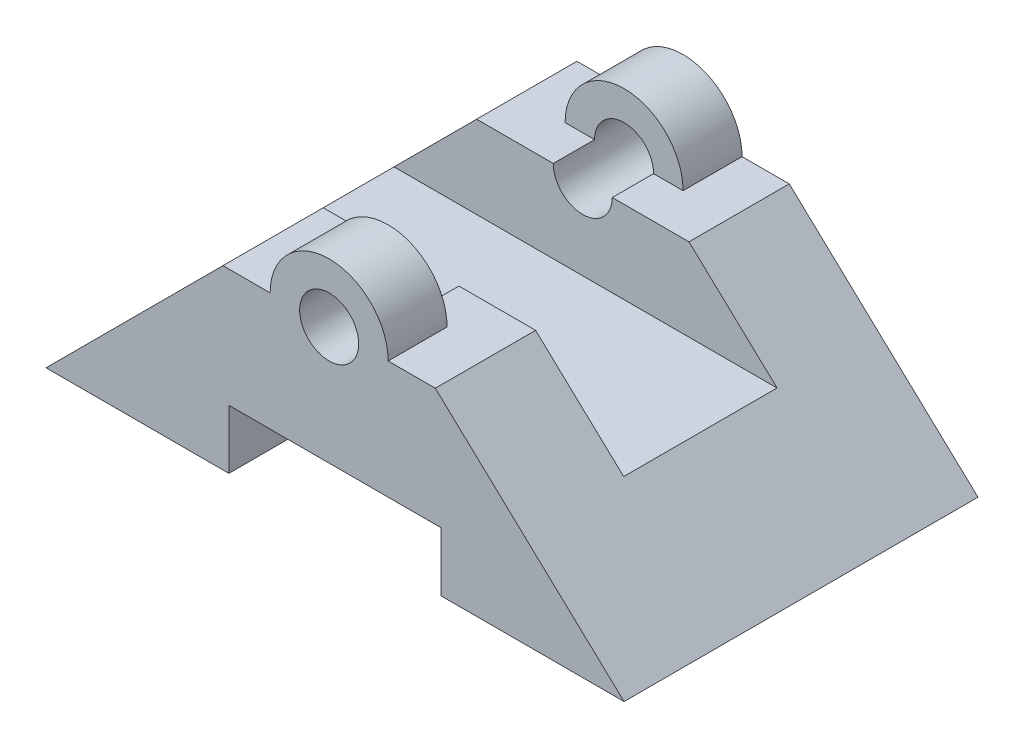
from build123d import *

# Parameters (mm, degrees)
BOSS_EXTRUDE1_DEPTH = 17
BOSS_EXTRUDE2_DEPTH = 10
SKETCH3_R           = 5
CUT_EXTRUDE1_DEPTH  = 17
BOSS_EXTRUDE3_DEPTH = 13


with BuildPart() as part:
    # Sketch1 → Boss-Extrude1 (new body)
    with BuildSketch(Plane.XY):
        Polygon((-35.219488433, -14.864106981), (-4.219488433, -14.864106981), (-4.219488433, -4.864106981), (31.780511567, -4.864106981), (31.780511567, -14.864106981), (62.780511567, -14.864106981), (30.780511567, 15.135893019), (20.780511567, 15.135893019), (4.780511567, 15.135893019), (-5.219488433, 15.135893019), align=None)
    extrude(amount=-BOSS_EXTRUDE1_DEPTH)

    # Sketch2 → Boss-Extrude2 (add)
    with BuildSketch(Plane.XY):
        with BuildLine():
            ThreePointArc((22.780511567, 15.135893019), (12.780511567, 25.135893019), (2.780511567, 15.135893019))
            Line((2.780511567, 15.135893019), (22.780511567, 15.135893019))
        make_face()
        with BuildLine():
            Line((22.780511567, 15.135893019), (2.780511567, 15.135893019))
            ThreePointArc((2.780511567, 15.135893019), (12.780511567, 5.135893019), (22.780511567, 15.135893019))
        make_face()
    extrude(amount=-BOSS_EXTRUDE2_DEPTH)

    # Sketch3 → Cut-Extrude1 (cut)
    with BuildSketch(Plane.XY):
        with Locations((12.780511567, 15.135893019)):
            Circle(SKETCH3_R)
    extrude(amount=-CUT_EXTRUDE1_DEPTH, mode=Mode.SUBTRACT)

    # Sketch4 → Boss-Extrude3 (add)
    with BuildSketch(Plane(origin=(0, 0, -17), x_dir=(-1, 0, 0), z_dir=(0, 0, -1))):
        Polygon((-62.780511567, -14.864106981), (-45.7138449, 1.135893019), (19.219488433, 1.135893019), (35.219488433, -14.864106981), (4.219488433, -14.864106981), (4.219488433, -4.864106981), (-31.780511567, -4.864106981), (-31.780511567, -14.864106981), align=None)
    extrude(amount=BOSS_EXTRUDE3_DEPTH)

    # Mirror9: part across plane


with BuildPart() as part_1:
    add(part.part)
    add(part.part.mirror(Plane(origin=(0, 0, -30), x_dir=(1, 0, 0), z_dir=(0, 0, -1))))


solid = part_1.part
